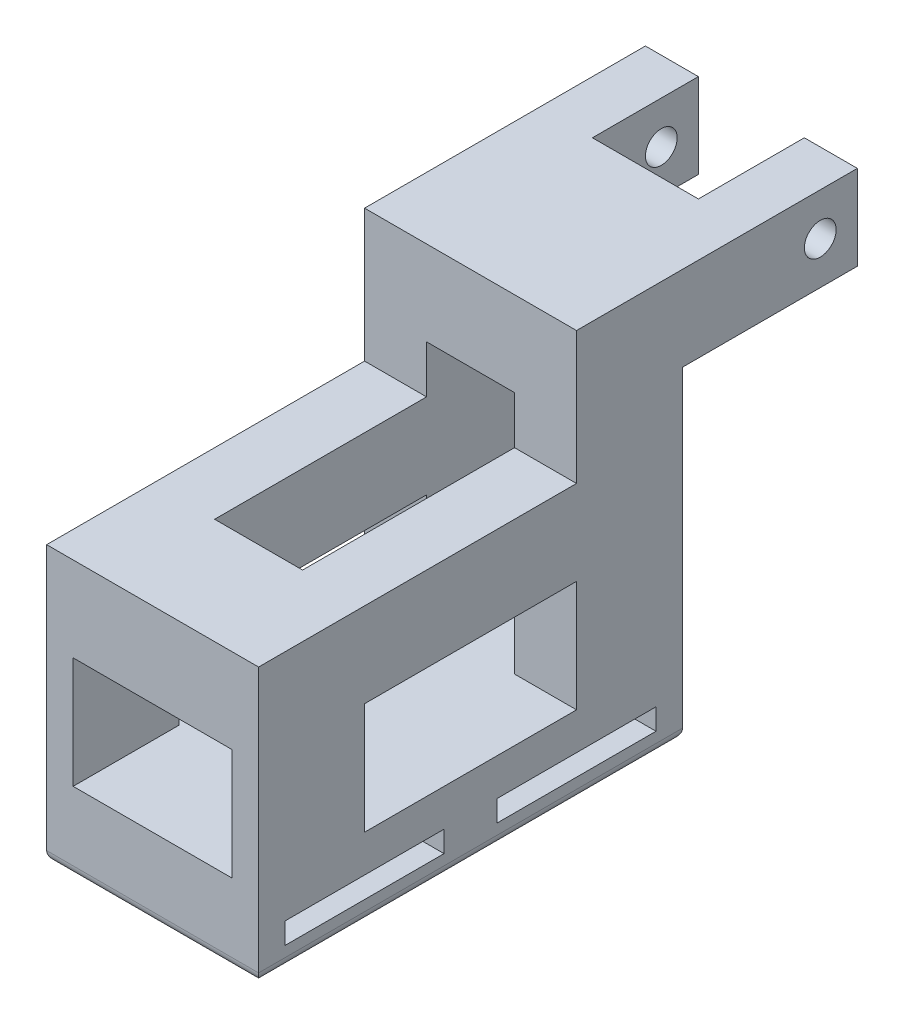
from build123d import *

# Parameters (mm, degrees)
CROQUIS1_R                 = 1.5
CROQUIS1_W                 = 20
CROQUIS1_H                 = 10.5
SALIENTE_EXTRUIR1_DEPTH    = 10
CORTAR_EXTRUIR1_REACH      = 72.33
CROQUIS2_W                 = 10
CROQUIS2_H                 = 10
CROQUIS5_W                 = 15
CROQUIS5_H                 = 10.5
CORTAR_EXTRUIR5_DEPTH      = 10
CORTAR_EXTRUIR4_DEPTH      = 62.923844357
CORTAR_EXTRUIR4_DEPTH_BACK = 62.923844357
CROQUIS4_W                 = 15
CROQUIS4_H                 = 2
CORTAR_EXTRUIR3_REACH      = 47.503
CROQUIS3_W                 = 8.3
CROQUIS3_H                 = 23
REDONDEO2_R                = 1


with BuildPart() as part:
    # Croquis1 → Saliente-Extruir1 (new, symmetric)
    with BuildSketch(Plane(origin=(0, 0, 0), x_dir=(0, 0, -1), z_dir=(1, 0, 0))):
        Polygon((-58, 6.75), (-58, -19.25), (-18, -19.25), (-18, -11.75), (-18, 11.25), (-1.5, 11.25), (-1.5, 19.25), (-28, 19.25), (-28, 6.75), align=None)
        with Locations((-5, 15.25)):
            Circle(CROQUIS1_R, mode=Mode.SUBTRACT)
        with Locations((-38, -6.5)):
            Rectangle(CROQUIS1_W, CROQUIS1_H, mode=Mode.SUBTRACT)
    extrude(amount=SALIENTE_EXTRUIR1_DEPTH, both=True)

    # Cortar-Extruir1: up to this face of the body (flat: up to its plane)
    cortar_extruir1_end = Plane(part.part.faces().sort_by_distance((0, 11.25, 9.75))[0])
    # Croquis2 → Cortar-Extruir1 (cut, up to the picked face)
    with BuildSketch(Plane(origin=(0, 19.25, 0), x_dir=(1, 0, 0), z_dir=(0, 1, 0)), mode=Mode.PRIVATE) as cortar_extruir1_sk1:
        with Locations((0, -6.5)):
            Rectangle(CROQUIS2_W, CROQUIS2_H)
    cortar_extruir1_tool1 = split(extrude(cortar_extruir1_sk1.sketch, amount=-CORTAR_EXTRUIR1_REACH, mode=Mode.PRIVATE), bisect_by=cortar_extruir1_end, keep=Keep.BOTH, mode=Mode.PRIVATE)
    add(cortar_extruir1_tool1.solids().sort_by(Axis((0, 19.25, 6.5), (0, -1, 0)))[0], mode=Mode.SUBTRACT)

    # Croquis5 → Cortar-Extruir5 (cut)
    with BuildSketch(Plane.XY.offset(58)):
        with Locations((0, -6.5)):
            Rectangle(CROQUIS5_W, CROQUIS5_H)
    extrude(amount=-CORTAR_EXTRUIR5_DEPTH, mode=Mode.SUBTRACT)

    # Croquis4 → Cortar-Extruir4 (cut, two sides: drawn at the far end of the back side and taken through both)
    with BuildSketch(Plane(origin=(0, 0, 0), x_dir=(0, 0, -1), z_dir=(1, 0, 0)).offset(-CORTAR_EXTRUIR4_DEPTH_BACK)):
        with Locations((-48, -16.25)):
            Rectangle(CROQUIS4_W, CROQUIS4_H)
        with Locations((-28, -16.25)):
            Rectangle(CROQUIS4_W, CROQUIS4_H)
    extrude(amount=CORTAR_EXTRUIR4_DEPTH + CORTAR_EXTRUIR4_DEPTH_BACK, mode=Mode.SUBTRACT)

    # Cortar-Extruir3: up to this face of the body (flat: up to its plane)
    cortar_extruir3_end = Plane(part.part.faces().sort_by_distance((-8.75, -6.5, 48))[0])
    # Croquis3 → Cortar-Extruir3 (cut, up to the picked face)
    with BuildSketch(Plane.XY.offset(18), mode=Mode.PRIVATE) as cortar_extruir3_sk1:
        with Locations((0, -0.25)):
            Rectangle(CROQUIS3_W, CROQUIS3_H)
    cortar_extruir3_tool1 = split(extrude(cortar_extruir3_sk1.sketch, amount=CORTAR_EXTRUIR3_REACH, mode=Mode.PRIVATE), bisect_by=cortar_extruir3_end, keep=Keep.BOTH, mode=Mode.PRIVATE)
    add(cortar_extruir3_tool1.solids().sort_by(Axis((0, -0.25, 18), (0, 0, 1)))[0], mode=Mode.SUBTRACT)

    # Redondeo2
    redondeo2_edges = [part.edges().sort_by_distance(p)[0] for p in [
        (-10, -19.25, 38),
        (0, -19.25, 58),
        (0, -19.25, 18),
        (10, -19.25, 38),
    ]]
    fillet(redondeo2_edges, radius=REDONDEO2_R)


solid = part.part
